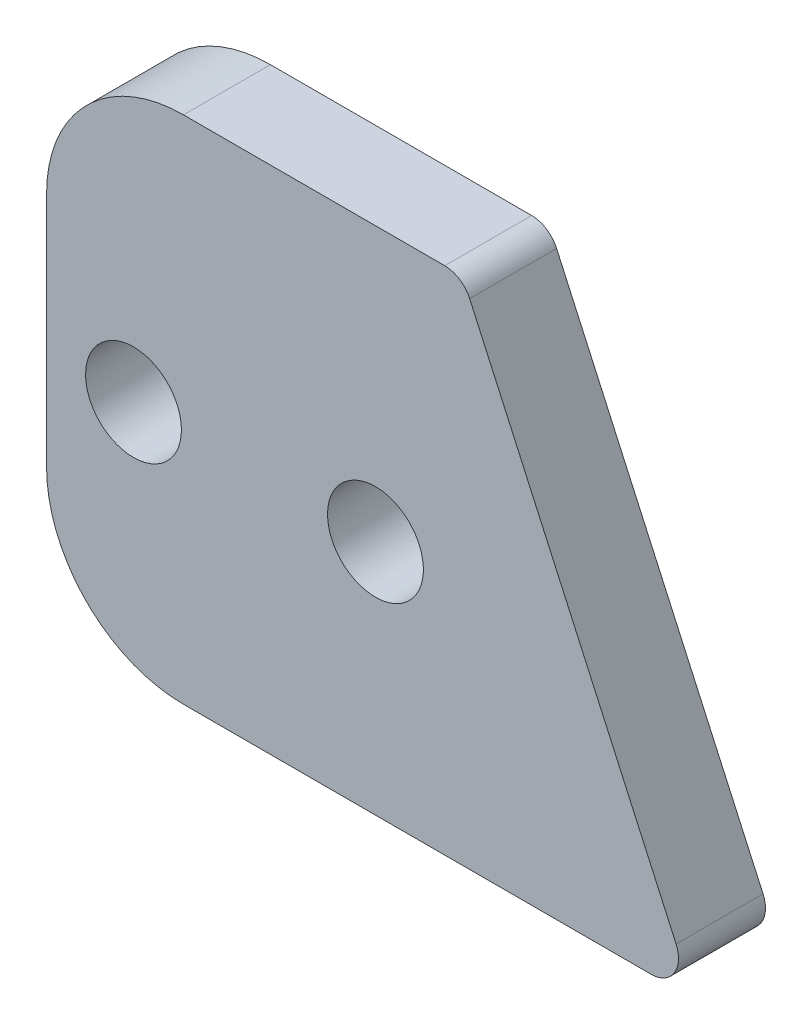
from build123d import *

# Parameters (mm, degrees)
BOSS_EXTRUDE1_DEPTH     = 1.5875
CUT_EXTRUDE1_DEPTH      = 16.380616986
CUT_EXTRUDE1_DEPTH_BACK = 16.380616986
SKETCH2_R               = 1.75
FILLET1_R               = 1
FILLET2_R               = 5


with BuildPart() as part:
    # Sketch1 → Boss-Extrude1 (new, symmetric)
    with BuildSketch(Plane.XY):
        Polygon((11.81540086, -9.32089354), (3.370357256, 9.32089354), (-11.81540086, 9.32089354), (-11.81540086, -9.32089354), align=None)
    extrude(amount=BOSS_EXTRUDE1_DEPTH, both=True)

    # Sketch2 → Cut-Extrude1 (cut, two sides: drawn at the far end of the back side and taken through both)
    with BuildSketch(Plane.XY.offset(1.5875).offset(-CUT_EXTRUDE1_DEPTH_BACK)):
        with Locations(Location((0.195357254, -0.67910646, 0), (0, 0, 180))):
            Circle(SKETCH2_R)
        with Locations((-8.640400858, -0.67910646)):
            Circle(SKETCH2_R)
    extrude(amount=CUT_EXTRUDE1_DEPTH + CUT_EXTRUDE1_DEPTH_BACK, mode=Mode.SUBTRACT)

    # Fillet1
    fillet1_edges = [part.edges().sort_by_distance(p)[0] for p in [
        (3.370357256, 9.32089354, 0),
        (11.81540086, -9.32089354, 0),
    ]]
    fillet(fillet1_edges, radius=FILLET1_R)

    # Fillet2
    fillet2_edges = [part.edges().sort_by_distance(p)[0] for p in [
        (-11.81540086, -9.32089354, 0),
        (-11.81540086, 9.32089354, 0),
    ]]
    fillet(fillet2_edges, radius=FILLET2_R)


solid = part.part
